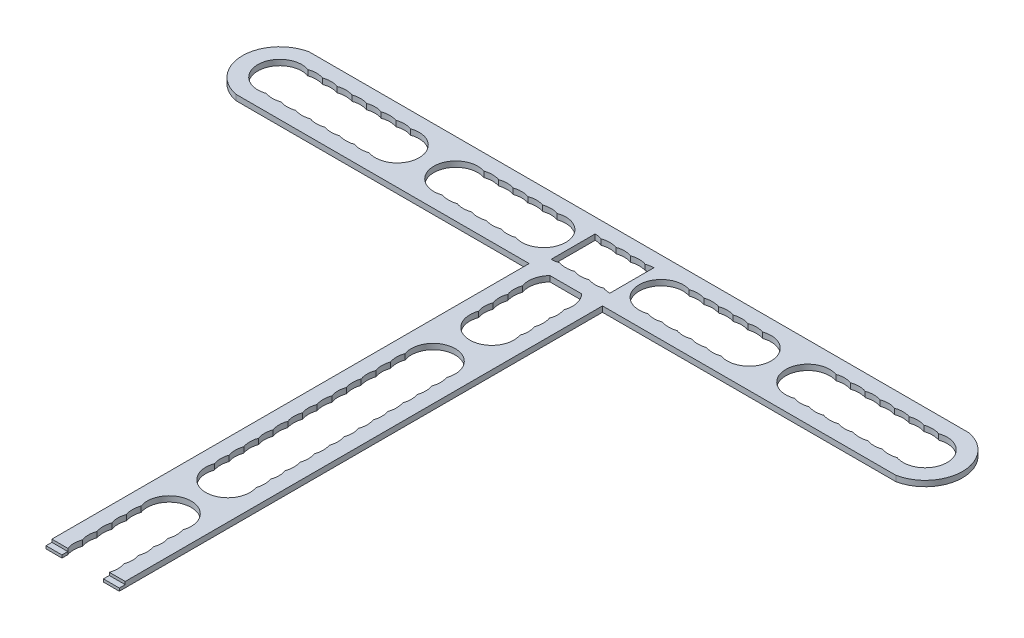
from build123d import *

# Parameters (mm, degrees)
BOSS_EXTRUDE1_DEPTH = 1.9
BOSS_EXTRUDE2_DEPTH = 1.9
SKETCH5_W           = 5.428932188
SKETCH5_H           = 2
BOSS_EXTRUDE3_DEPTH = 0.95


with BuildPart() as part:
    # Sketch3 → Boss-Extrude1 (new body)
    with BuildSketch(Plane(origin=(0, 0, 0), x_dir=(1, 0, 0), z_dir=(0, 1, 0))):
        with BuildLine():
            Line((0, -7.5), (0, -12.5))
            Line((0, -12.5), (112.5, -12.5))
            ThreePointArc((112.5, -12.5), (122.747548784, 0), (112.5, 12.5))
            Line((112.5, 12.5), (0, 12.5))
            Line((0, 12.5), (0, 7.5))
            ThreePointArc((0, 7.5), (1.26826484, 7.391989197), (2.5, 7.071067812))
            ThreePointArc((2.5, 7.071067812), (5, 7.5), (7.5, 7.071067812))
            ThreePointArc((7.5, 7.071067812), (8.73173516, 7.391989197), (10, 7.5))
            Line((10, 7.5), (10, -7.5))
            ThreePointArc((10, -7.5), (8.73173516, -7.391989197), (7.5, -7.071067812))
            ThreePointArc((7.5, -7.071067812), (5, -7.5), (2.5, -7.071067812))
            ThreePointArc((2.5, -7.071067812), (1.26826484, -7.391989197), (0, -7.5))
        make_face()
        with BuildLine():
            ThreePointArc((22.5, 7.071067812), (25, 7.5), (27.5, 7.071067812))
            ThreePointArc((27.5, 7.071067812), (30, 7.5), (32.5, 7.071067812))
            ThreePointArc((32.5, 7.071067812), (35, 7.5), (37.5, 7.071067812))
            ThreePointArc((37.5, 7.071067812), (40, 7.5), (42.5, 7.071067812))
            ThreePointArc((42.5, 7.071067812), (45, 7.5), (47.5, 7.071067812))
            ThreePointArc((47.5, 7.071067812), (57.5, 0), (47.5, -7.071067812))
            ThreePointArc((47.5, -7.071067812), (45, -7.5), (42.5, -7.071067812))
            ThreePointArc((42.5, -7.071067812), (40, -7.5), (37.5, -7.071067812))
            ThreePointArc((37.5, -7.071067812), (35, -7.5), (32.5, -7.071067812))
            ThreePointArc((32.5, -7.071067812), (30, -7.5), (27.5, -7.071067812))
            ThreePointArc((27.5, -7.071067812), (25, -7.5), (22.5, -7.071067812))
            ThreePointArc((22.5, -7.071067812), (12.5, 0), (22.5, 7.071067812))
        make_face(mode=Mode.SUBTRACT)
        with BuildLine():
            ThreePointArc((72.5, 7.071067812), (75, 7.5), (77.5, 7.071067812))
            ThreePointArc((77.5, 7.071067812), (80, 7.5), (82.5, 7.071067812))
            ThreePointArc((82.5, 7.071067812), (85, 7.5), (87.5, 7.071067812))
            ThreePointArc((87.5, 7.071067812), (90, 7.5), (92.5, 7.071067812))
            ThreePointArc((92.5, 7.071067812), (95, 7.5), (97.5, 7.071067812))
            ThreePointArc((97.5, 7.071067812), (100, 7.5), (102.5, 7.071067812))
            ThreePointArc((102.5, 7.071067812), (105, 7.5), (107.5, 7.071067812))
            ThreePointArc((107.5, 7.071067812), (117.5, 0), (107.5, -7.071067812))
            ThreePointArc((107.5, -7.071067812), (105, -7.5), (102.5, -7.071067812))
            ThreePointArc((102.5, -7.071067812), (100, -7.5), (97.5, -7.071067812))
            ThreePointArc((97.5, -7.071067812), (95, -7.5), (92.5, -7.071067812))
            ThreePointArc((92.5, -7.071067812), (90, -7.5), (87.5, -7.071067812))
            ThreePointArc((87.5, -7.071067812), (85, -7.5), (82.5, -7.071067812))
            ThreePointArc((82.5, -7.071067812), (80, -7.5), (77.5, -7.071067812))
            ThreePointArc((77.5, -7.071067812), (75, -7.5), (72.5, -7.071067812))
            ThreePointArc((72.5, -7.071067812), (62.5, 0), (72.5, 7.071067812))
        make_face(mode=Mode.SUBTRACT)
    boss_extrude1 = extrude(amount=BOSS_EXTRUDE1_DEPTH)

    # Mirror1: Boss-Extrude1 across plane
    add(boss_extrude1.mirror(Plane(origin=(0, 0, 0), x_dir=(0, 0, 1), z_dir=(1, 0, 0))))

    # Sketch4 → Boss-Extrude2 (add)
    with BuildSketch(Plane(origin=(0, 0, 0), x_dir=(1, 0, 0), z_dir=(0, 1, 0))):
        with BuildLine():
            Line((-12.5, -12.5), (-12.5, -175.214466094))
            Line((-12.5, -175.214466094), (-7.071067812, -175.214466094))
            ThreePointArc((-7.071067812, -175.214466094), (-7.5, -172.714466094), (-7.071067812, -170.214466094))
            ThreePointArc((-7.071067812, -170.214466094), (-7.5, -167.714466094), (-7.071067812, -165.214466094))
            ThreePointArc((-7.071067812, -165.214466094), (-7.5, -162.714466094), (-7.071067812, -160.214466094))
            ThreePointArc((-7.071067812, -160.214466094), (-7.5, -157.714466094), (-7.071067812, -155.214466094))
            ThreePointArc((-7.071067812, -155.214466094), (-7.5, -152.714466094), (-7.071067812, -150.214466094))
            ThreePointArc((-7.071067812, -150.214466094), (0, -140.214466094), (7.071067812, -150.214466094))
            ThreePointArc((7.071067812, -150.214466094), (7.5, -152.714466094), (7.071067812, -155.214466094))
            ThreePointArc((7.071067812, -155.214466094), (7.5, -157.714466094), (7.071067812, -160.214466094))
            ThreePointArc((7.071067812, -160.214466094), (7.5, -162.714466094), (7.071067812, -165.214466094))
            ThreePointArc((7.071067812, -165.214466094), (7.5, -167.714466094), (7.071067812, -170.214466094))
            ThreePointArc((7.071067812, -170.214466094), (7.5, -172.714466094), (7.071067812, -175.214466094))
            Line((7.071067812, -175.214466094), (12.5, -175.214466094))
            Line((12.5, -175.214466094), (12.5, -12.5))
            Line((12.5, -12.5), (5.390671883, -12.5))
            ThreePointArc((5.390671883, -12.5), (7.328163879, -16.118216063), (7.071067812, -20.214466094))
            ThreePointArc((7.071067812, -20.214466094), (7.5, -22.714466094), (7.071067812, -25.214466094))
            ThreePointArc((7.071067812, -25.214466094), (7.5, -27.714466094), (7.071067812, -30.214466094))
            ThreePointArc((7.071067812, -30.214466094), (7.5, -32.714466094), (7.071067812, -35.214466094))
            ThreePointArc((7.071067812, -35.214466094), (0, -45.214466094), (-7.071067812, -35.214466094))
            ThreePointArc((-7.071067812, -35.214466094), (-7.5, -32.714466094), (-7.071067812, -30.214466094))
            ThreePointArc((-7.071067812, -30.214466094), (-7.5, -27.714466094), (-7.071067812, -25.214466094))
            ThreePointArc((-7.071067812, -25.214466094), (-7.5, -22.714466094), (-7.071067812, -20.214466094))
            ThreePointArc((-7.071067812, -20.214466094), (-7.328163879, -16.118216063), (-5.390671883, -12.5))
            Line((-5.390671883, -12.5), (-12.5, -12.5))
        make_face()
        with BuildLine():
            ThreePointArc((7.071067812, -60.214466094), (7.5, -62.714466094), (7.071067812, -65.214466094))
            ThreePointArc((7.071067812, -65.214466094), (7.5, -67.714466094), (7.071067812, -70.214466094))
            ThreePointArc((7.071067812, -70.214466094), (7.5, -72.714466094), (7.071067812, -75.214466094))
            ThreePointArc((7.071067812, -75.214466094), (7.5, -77.714466094), (7.071067812, -80.214466094))
            ThreePointArc((7.071067812, -80.214466094), (7.5, -82.714466094), (7.071067812, -85.214466094))
            ThreePointArc((7.071067812, -85.214466094), (7.5, -87.714466094), (7.071067812, -90.214466094))
            ThreePointArc((7.071067812, -90.214466094), (7.5, -92.714466094), (7.071067812, -95.214466094))
            ThreePointArc((7.071067812, -95.214466094), (7.5, -97.714466094), (7.071067812, -100.214466094))
            ThreePointArc((7.071067812, -100.214466094), (7.5, -102.714466094), (7.071067812, -105.214466094))
            ThreePointArc((7.071067812, -105.214466094), (7.5, -107.714466094), (7.071067812, -110.214466094))
            ThreePointArc((7.071067812, -110.214466094), (7.5, -112.714466094), (7.071067812, -115.214466094))
            ThreePointArc((7.071067812, -115.214466094), (7.5, -117.714466094), (7.071067812, -120.214466094))
            ThreePointArc((7.071067812, -120.214466094), (7.5, -122.714466094), (7.071067812, -125.214466094))
            ThreePointArc((7.071067812, -125.214466094), (0, -135.214466094), (-7.071067812, -125.214466094))
            ThreePointArc((-7.071067812, -125.214466094), (-7.5, -122.714466094), (-7.071067812, -120.214466094))
            ThreePointArc((-7.071067812, -120.214466094), (-7.5, -117.714466094), (-7.071067812, -115.214466094))
            ThreePointArc((-7.071067812, -115.214466094), (-7.5, -112.714466094), (-7.071067812, -110.214466094))
            ThreePointArc((-7.071067812, -110.214466094), (-7.5, -107.714466094), (-7.071067812, -105.214466094))
            ThreePointArc((-7.071067812, -105.214466094), (-7.5, -102.714466094), (-7.071067812, -100.214466094))
            ThreePointArc((-7.071067812, -100.214466094), (-7.5, -97.714466094), (-7.071067812, -95.214466094))
            ThreePointArc((-7.071067812, -95.214466094), (-7.5, -92.714466094), (-7.071067812, -90.214466094))
            ThreePointArc((-7.071067812, -90.214466094), (-7.5, -87.714466094), (-7.071067812, -85.214466094))
            ThreePointArc((-7.071067812, -85.214466094), (-7.5, -82.714466094), (-7.071067812, -80.214466094))
            ThreePointArc((-7.071067812, -80.214466094), (-7.5, -77.714466094), (-7.071067812, -75.214466094))
            ThreePointArc((-7.071067812, -75.214466094), (-7.5, -72.714466094), (-7.071067812, -70.214466094))
            ThreePointArc((-7.071067812, -70.214466094), (-7.5, -67.714466094), (-7.071067812, -65.214466094))
            ThreePointArc((-7.071067812, -65.214466094), (-7.5, -62.714466094), (-7.071067812, -60.214466094))
            ThreePointArc((-7.071067812, -60.214466094), (0, -50.214466094), (7.071067812, -60.214466094))
        make_face(mode=Mode.SUBTRACT)
    extrude(amount=BOSS_EXTRUDE2_DEPTH)

    # Sketch5 → Boss-Extrude3 (add)
    with BuildSketch(Plane(origin=(0, 0, 0), x_dir=(1, 0, 0), z_dir=(0, 1, 0))):
        with Locations((-9.785533906, -176.214466094)):
            Rectangle(SKETCH5_W, SKETCH5_H)
        with Locations((9.785533906, -176.214466094)):
            Rectangle(SKETCH5_W, SKETCH5_H)
    extrude(amount=BOSS_EXTRUDE3_DEPTH)


solid = part.part
